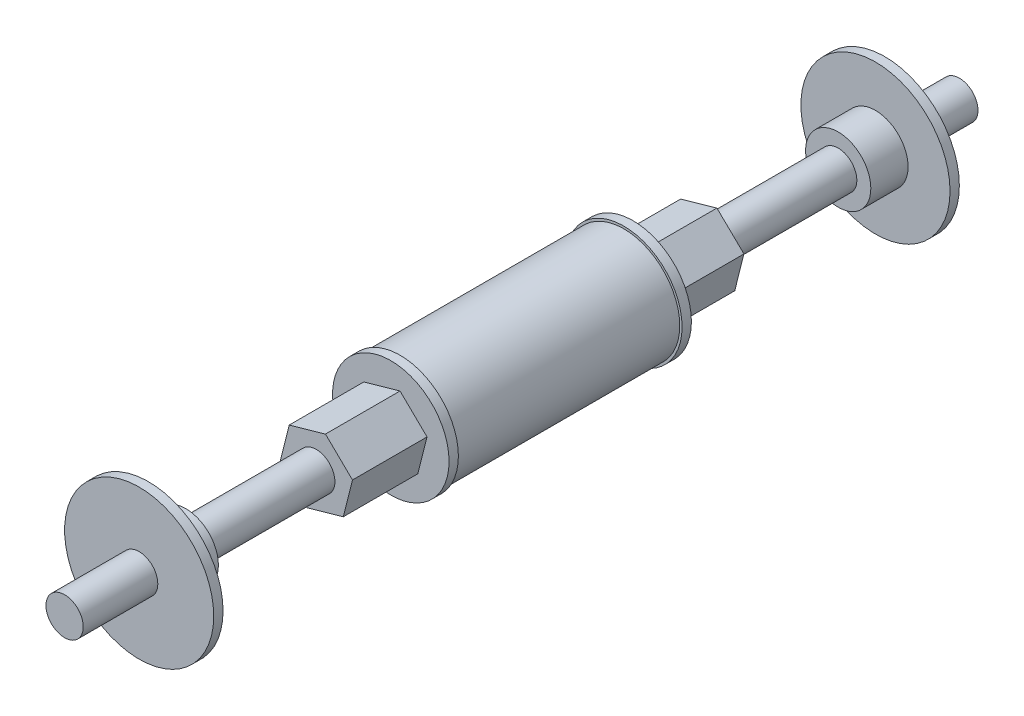
from build123d import *

# Parameters (mm, degrees)
SKETCH1_R           = 9.525
BOSS_EXTRUDE1_DEPTH = 19.05
SKETCH2_R           = 9.921875
BOSS_EXTRUDE2_DEPTH = 1.5875
BOSS_EXTRUDE3_DEPTH = 12.7
SKETCH4_R           = 3.175
BOSS_EXTRUDE4_DEPTH = 22.225
SKETCH5_R           = 5.55625
BOSS_EXTRUDE6_DEPTH = 6.35
SKETCH6_R           = 12.7
BOSS_EXTRUDE7_DEPTH = 1.5875
SKETCH7_R           = 3.175
BOSS_EXTRUDE8_DEPTH = 12.7


with BuildPart() as part:
    # Sketch1 → Boss-Extrude1 (new body)
    with BuildSketch(Plane.XY):
        Circle(SKETCH1_R)
    boss_extrude1 = extrude(amount=BOSS_EXTRUDE1_DEPTH)

    # Sketch2 → Boss-Extrude2 (add)
    with BuildSketch(Plane.XY.offset(19.05)):
        Circle(SKETCH2_R)
    boss_extrude2 = extrude(amount=BOSS_EXTRUDE2_DEPTH)

    # Sketch3 → Boss-Extrude3 (add)
    with BuildSketch(Plane.XY.offset(20.6375)):
        Polygon((4.603141218, -4.469188183), (6.17200111, 1.75184314), (1.568859892, 6.221031323), (-4.603141218, 4.469188183), (-6.17200111, -1.75184314), (-1.568859892, -6.221031323), align=None)
    boss_extrude3 = extrude(amount=BOSS_EXTRUDE3_DEPTH)

    # Sketch4 → Boss-Extrude4 (add)
    with BuildSketch(Plane.XY.offset(33.3375)):
        Circle(SKETCH4_R)
    boss_extrude4 = extrude(amount=BOSS_EXTRUDE4_DEPTH)

    # Sketch5 → Boss-Extrude6 (add)
    with BuildSketch(Plane.XY.offset(55.5625)):
        Circle(SKETCH5_R)
    boss_extrude6 = extrude(amount=BOSS_EXTRUDE6_DEPTH)

    # Sketch6 → Boss-Extrude7 (add)
    with BuildSketch(Plane.XY.offset(61.9125)):
        Circle(SKETCH6_R)
    boss_extrude7 = extrude(amount=BOSS_EXTRUDE7_DEPTH)

    # Sketch7 → Boss-Extrude8 (add)
    with BuildSketch(Plane.XY.offset(63.5)):
        Circle(SKETCH7_R)
    boss_extrude8 = extrude(amount=BOSS_EXTRUDE8_DEPTH)

    # Mirror1: Boss-Extrude1, Boss-Extrude2, Boss-Extrude3, Boss-Extrude4, Boss-Extrude6, Boss-Extrude7, Boss-Extrude8 across plane
    add(boss_extrude1.mirror(Plane.XY))
    add(boss_extrude2.mirror(Plane.XY))
    add(boss_extrude3.mirror(Plane.XY))
    add(boss_extrude4.mirror(Plane.XY))
    add(boss_extrude6.mirror(Plane.XY))
    add(boss_extrude7.mirror(Plane.XY))
    add(boss_extrude8.mirror(Plane.XY))


solid = part.part
